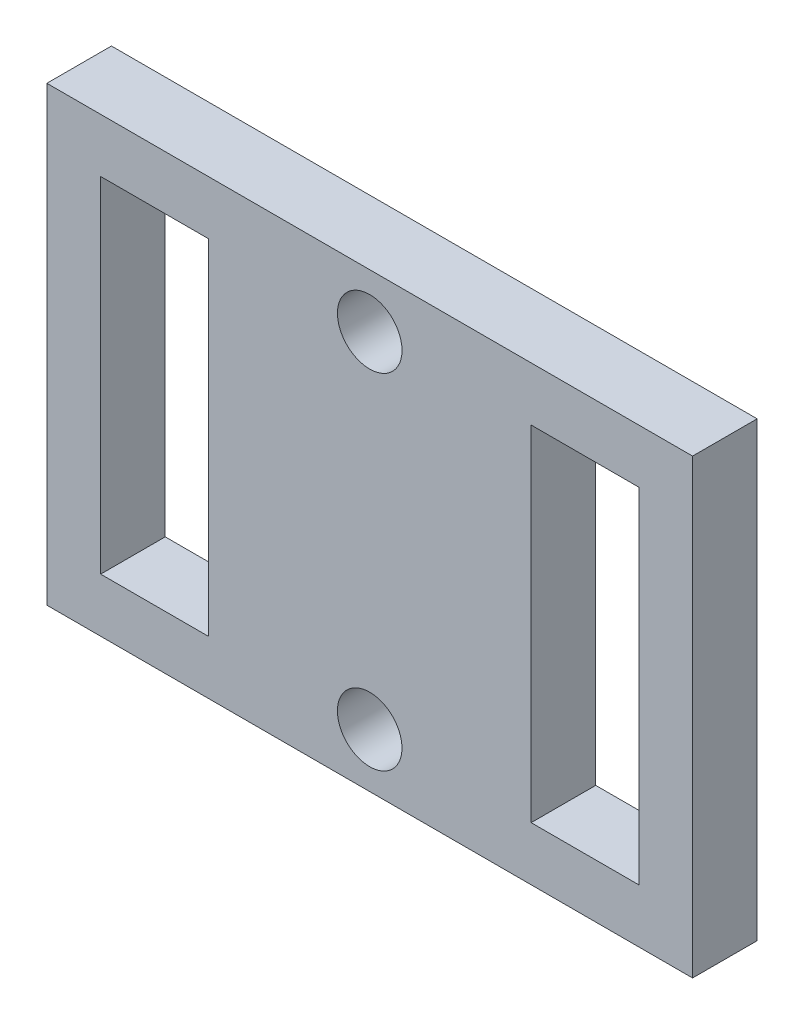
from build123d import *

# Parameters (mm, degrees)
SKETCH_1_W          = 30
SKETCH_1_H          = 21
SKETCH_1_R          = 1.5
EXTRUDE_1_DEPTH     = 3
SKETCH_2_W          = 5
SKETCH_2_H          = 16
CUT_EXTRUDE_1_DEPTH = 19.553975315


with BuildPart() as part:
    # 草图1 → 凸台-拉伸1 (new body)
    with BuildSketch(Plane.XY):
        Rectangle(SKETCH_1_W, SKETCH_1_H)
        with Locations((0, 8)):
            Circle(SKETCH_1_R, mode=Mode.SUBTRACT)
        with Locations(Location((0, -8, 0), (0, 0, 180))):
            Circle(SKETCH_1_R, mode=Mode.SUBTRACT)
    extrude(amount=EXTRUDE_1_DEPTH)

    # 草图2 → 切除-拉伸1 (cut, through all)
    with BuildSketch(Plane.XY.offset(3)):
        with Locations((-10, 0)):
            Rectangle(SKETCH_2_W, SKETCH_2_H)
        with Locations((10, 0)):
            Rectangle(SKETCH_2_W, SKETCH_2_H)
    extrude(amount=-CUT_EXTRUDE_1_DEPTH, mode=Mode.SUBTRACT)


solid = part.part
